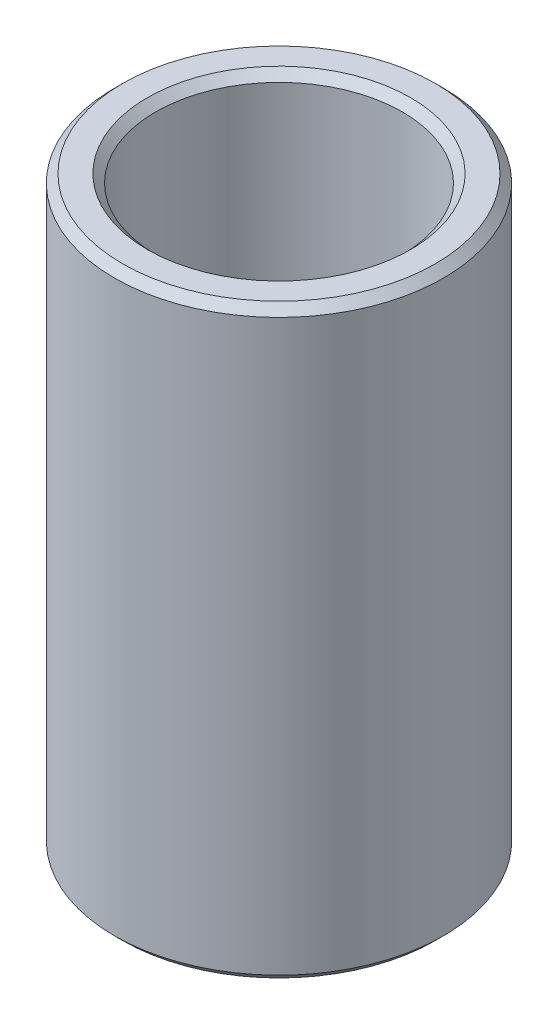
from build123d import *

# Parameters (mm, degrees)
SKIZZE1_R                       = 4
SKIZZE1_R_2                     = 3
AUFSATZ_LINEAR_AUSTRAGEN1_DEPTH = 14.25
FASE1_SIZE                      = 0.2


with BuildPart() as part:
    # Skizze1 → Aufsatz-Linear austragen1 (new body)
    with BuildSketch(Plane(origin=(0, 0, 0), x_dir=(1, 0, 0), z_dir=(0, 1, 0))):
        with Locations(Location((0, 0, 0), (0, 0, 90))):
            Circle(SKIZZE1_R)
        with Locations(Location((0, 0, 0), (0, 0, 90))):
            Circle(SKIZZE1_R_2, mode=Mode.SUBTRACT)
    extrude(amount=AUFSATZ_LINEAR_AUSTRAGEN1_DEPTH)

    # Fase1
    fase1_edges = [part.edges().sort_by_distance(p)[0] for p in [
        (0, 0, 4),
        (0, 14.25, 4),
        (0, 0, 3),
        (0, 14.25, 3),
    ]]
    chamfer(fase1_edges, length=FASE1_SIZE)


solid = part.part
